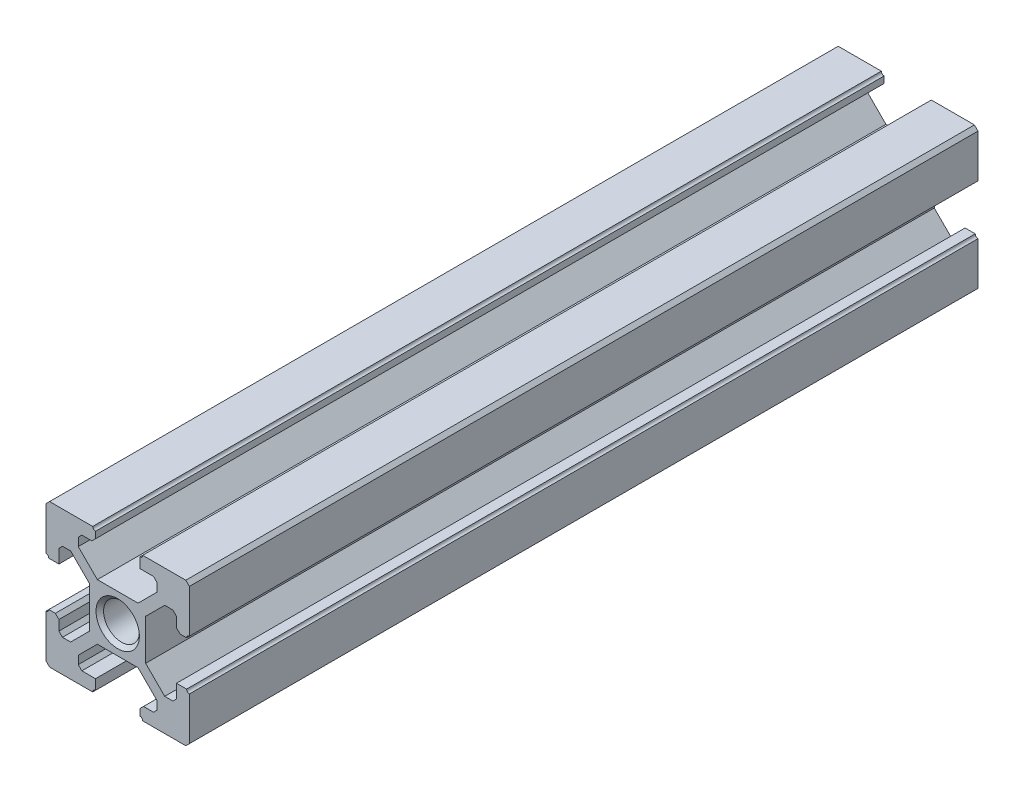
from build123d import *

# Parameters (mm, degrees)
BOSS_EXTRUDE1_DEPTH             = 110
M6X1_0_TAPPED_HOLE2_D           = 5
M6X1_0_TAPPED_HOLE2_DEPTH       = 28.497848452
M6X1_0_TAPPED_HOLE2_CSINK_D     = 6.05
M6X1_0_TAPPED_HOLE2_CSINK_ANGLE = 90
M6X1_0_TAPPED_HOLE2_TIP         = 1.502151548


with BuildPart() as part:
    # Sketch1 → Boss-Extrude1 (new body)
    with BuildSketch(Plane.XY):
        with BuildLine():
            Line((-9.5, 10), (-3.486470896, 10))
            ThreePointArc((-3.486470896, 10), (-3.373276191, 9.726723809), (-3.1, 9.613529104))
            Line((-3.1, 9.613529104), (-3.1, 8.7))
            Line((-3.1, 8.7), (-3.6, 8.2))
            Line((-3.6, 8.2), (-5, 8.2))
            Line((-5, 8.2), (-5.5, 7.7))
            Line((-5.5, 7.7), (-5.5, 6.560660172))
            Line((-5.5, 6.560660172), (-2.839339828, 3.9))
            Line((-2.839339828, 3.9), (0, 3.9))
            Line((0, 3.9), (2.839339828, 3.9))
            Line((2.839339828, 3.9), (5.5, 6.560660172))
            Line((5.5, 6.560660172), (5.5, 7.7))
            Line((5.5, 7.7), (5, 8.2))
            Line((5, 8.2), (3.1, 8.2))
            Line((3.1, 8.2), (3.1, 9.613529104))
            ThreePointArc((3.1, 9.613529104), (3.373276191, 9.726723809), (3.486470896, 10))
            Line((3.486470896, 10), (9.5, 10))
            Line((9.5, 10), (10, 9.5))
            Line((10, 9.5), (10, 3.486470896))
            ThreePointArc((10, 3.486470896), (9.726723809, 3.373276191), (9.613529104, 3.1))
            Line((9.613529104, 3.1), (8.7, 3.1))
            Line((8.7, 3.1), (8.2, 3.6))
            Line((8.2, 3.6), (8.2, 5))
            Line((8.2, 5), (7.7, 5.5))
            Line((7.7, 5.5), (6.560660172, 5.5))
            Line((6.560660172, 5.5), (3.9, 2.839339828))
            Line((3.9, 2.839339828), (3.9, 0))
            Line((3.9, 0), (3.9, -2.839339828))
            Line((3.9, -2.839339828), (6.560660172, -5.5))
            Line((6.560660172, -5.5), (7.7, -5.5))
            Line((7.7, -5.5), (8.2, -5))
            Line((8.2, -5), (8.2, -3.1))
            Line((8.2, -3.1), (9.613529104, -3.1))
            ThreePointArc((9.613529104, -3.1), (9.726723809, -3.373276191), (10, -3.486470896))
            Line((10, -3.486470896), (10, -9.5))
            Line((10, -9.5), (9.5, -10))
            Line((9.5, -10), (3.486470896, -10))
            ThreePointArc((3.486470896, -10), (3.373276191, -9.726723809), (3.1, -9.613529104))
            Line((3.1, -9.613529104), (3.1, -8.7))
            Line((3.1, -8.7), (3.6, -8.2))
            Line((3.6, -8.2), (5, -8.2))
            Line((5, -8.2), (5.5, -7.7))
            Line((5.5, -7.7), (5.5, -6.560660172))
            Line((5.5, -6.560660172), (2.839339828, -3.9))
            Line((2.839339828, -3.9), (0, -3.9))
            Line((0, -3.9), (-2.839339828, -3.9))
            Line((-2.839339828, -3.9), (-5.5, -6.560660172))
            Line((-5.5, -6.560660172), (-5.5, -7.7))
            Line((-5.5, -7.7), (-5, -8.2))
            Line((-5, -8.2), (-3.1, -8.2))
            Line((-3.1, -8.2), (-3.1, -9.613529104))
            ThreePointArc((-3.1, -9.613529104), (-3.373276191, -9.726723809), (-3.486470896, -10))
            Line((-3.486470896, -10), (-9.5, -10))
            Line((-9.5, -10), (-10, -9.5))
            Line((-10, -9.5), (-10, -3.486470896))
            ThreePointArc((-10, -3.486470896), (-9.726723809, -3.373276191), (-9.613529104, -3.1))
            Line((-9.613529104, -3.1), (-8.7, -3.1))
            Line((-8.7, -3.1), (-8.2, -3.6))
            Line((-8.2, -3.6), (-8.2, -5))
            Line((-8.2, -5), (-7.7, -5.5))
            Line((-7.7, -5.5), (-6.560660172, -5.5))
            Line((-6.560660172, -5.5), (-3.9, -2.839339828))
            Line((-3.9, -2.839339828), (-3.9, 0))
            Line((-3.9, 0), (-3.9, 2.839339828))
            Line((-3.9, 2.839339828), (-6.560660172, 5.5))
            Line((-6.560660172, 5.5), (-7.7, 5.5))
            Line((-7.7, 5.5), (-8.2, 5))
            Line((-8.2, 5), (-8.2, 3.1))
            Line((-8.2, 3.1), (-9.613529104, 3.1))
            ThreePointArc((-9.613529104, 3.1), (-9.726723809, 3.373276191), (-10, 3.486470896))
            Line((-10, 3.486470896), (-10, 9.5))
            Line((-10, 9.5), (-9.5, 10))
        make_face()
    extrude(amount=BOSS_EXTRUDE1_DEPTH)

    # Sketch2 → M6x1.0 Tapped Hole1 (revolve, cut)
    with BuildSketch(Plane(origin=(0, 0, 110), x_dir=(0, -1, 0), z_dir=(1, 0, 0))):
        Polygon((0, 0), (0, 30), (2.5, 28.497848452), (2.5, 0.525), (3.025, 0), align=None)
    revolve(axis=Axis((0, 0, 116.35), (0, 0, -1)), mode=Mode.SUBTRACT)

    # M6x1.0 Tapped Hole2
    with Locations(Plane(origin=(0, 0, 0), x_dir=(-1, 0, 0), z_dir=(0, 0, -1))):
        with Locations((0, 0)):
            CounterSinkHole(M6X1_0_TAPPED_HOLE2_D / 2, M6X1_0_TAPPED_HOLE2_CSINK_D / 2, depth=M6X1_0_TAPPED_HOLE2_DEPTH, counter_sink_angle=M6X1_0_TAPPED_HOLE2_CSINK_ANGLE)
            with Locations((0, 0, -(M6X1_0_TAPPED_HOLE2_DEPTH + M6X1_0_TAPPED_HOLE2_TIP / 2))):  # 118° drill point
                Cone(0, M6X1_0_TAPPED_HOLE2_D / 2, M6X1_0_TAPPED_HOLE2_TIP, mode=Mode.SUBTRACT)


solid = part.part
